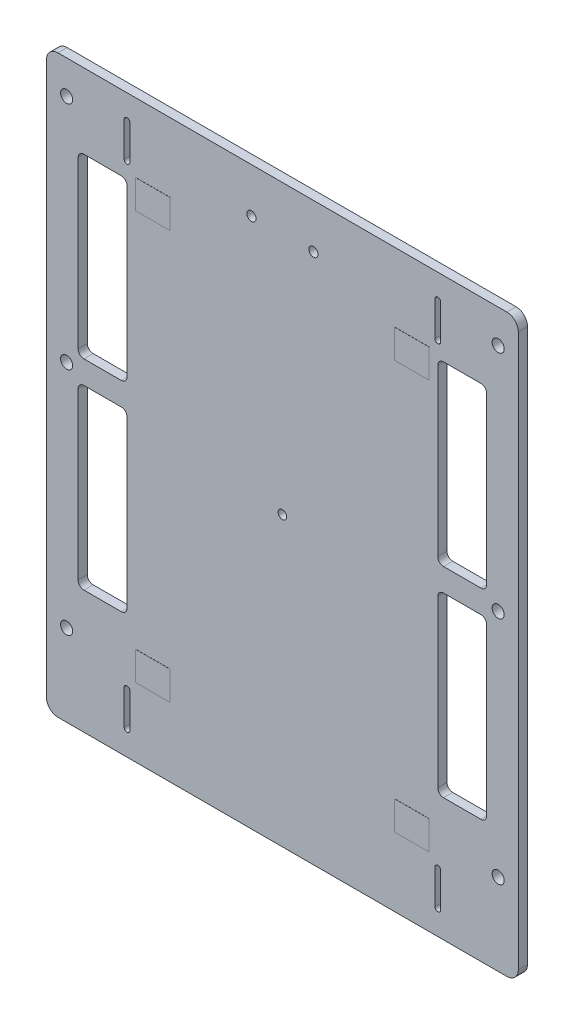
from build123d import *

# Parameters (mm, degrees)
BOSS_EXTRUDE1_DEPTH = 1.6
SKETCH2_R           = 0.75
SKETCH2_R_2         = 1.05
SKETCH2_R_3         = 0.8
CUT_EXTRUDE1_DEPTH  = 65.680445267
CUT_EXTRUDE2_DEPTH  = 65.680445267
CUT_EXTRUDE3_DEPTH  = 1.6
SKETCH5_W           = 6
SKETCH5_H           = 5
BOSS_EXTRUDE2_DEPTH = 0.02


with BuildPart() as part:
    # Sketch1 → Boss-Extrude1 (new body)
    with BuildSketch(Plane.XY):
        with BuildLine():
            Line((-39, -50), (39, -50))
            ThreePointArc((39, -50), (40.414213562, -49.414213562), (41, -48))
            Line((41, -48), (41, 48))
            ThreePointArc((41, 48), (40.414213562, 49.414213562), (39, 50))
            Line((39, 50), (-39, 50))
            ThreePointArc((-39, 50), (-40.414213562, 49.414213562), (-41, 48))
            Line((-41, 48), (-41, -48))
            ThreePointArc((-41, -48), (-40.414213562, -49.414213562), (-39, -50))
        make_face()
    extrude(amount=BOSS_EXTRUDE1_DEPTH)

    # Sketch2 → Cut-Extrude1 (cut, through all)
    with BuildSketch(Plane.XY.offset(1.6)):
        Circle(SKETCH2_R)
        with Locations((-37.5, 44.2)):
            Circle(SKETCH2_R_2)
        with Locations((37.5, 44.2)):
            Circle(SKETCH2_R_2)
        with Locations((37.5, 4.2)):
            Circle(SKETCH2_R_2)
        with Locations((37.5, -35.8)):
            Circle(SKETCH2_R_2)
        with Locations((-37.5, 4.2)):
            Circle(SKETCH2_R_2)
        with Locations((-37.5, -35.8)):
            Circle(SKETCH2_R_2)
        with Locations((-5.38, 42.25)):
            Circle(SKETCH2_R_3)
        with Locations((5.39, 42.25)):
            Circle(SKETCH2_R_3)
    extrude(amount=-CUT_EXTRUDE1_DEPTH, mode=Mode.SUBTRACT)

    # Sketch3 → Cut-Extrude2 (cut, through all)
    with BuildSketch(Plane.XY.offset(1.6)):
        with BuildLine():
            Line((-34.5, 37), (-28, 37))
            ThreePointArc((-28, 37), (-27.292893219, 36.707106781), (-27, 36))
            Line((-27, 36), (-27, 7.2))
            ThreePointArc((-27, 7.2), (-27.292893219, 6.492893219), (-28, 6.2))
            Line((-28, 6.2), (-34.5, 6.2))
            ThreePointArc((-34.5, 6.2), (-35.207106781, 6.492893219), (-35.5, 7.2))
            Line((-35.5, 7.2), (-35.5, 36))
            ThreePointArc((-35.5, 36), (-35.207106781, 36.707106781), (-34.5, 37))
        make_face()
        with BuildLine():
            Line((28, 37), (34.5, 37))
            ThreePointArc((34.5, 37), (35.207106781, 36.707106781), (35.5, 36))
            Line((35.5, 36), (35.5, 7.2))
            ThreePointArc((35.5, 7.2), (35.207106781, 6.492893219), (34.5, 6.2))
            Line((34.5, 6.2), (28, 6.2))
            ThreePointArc((28, 6.2), (27.292893219, 6.492893219), (27, 7.2))
            Line((27, 7.2), (27, 36))
            ThreePointArc((27, 36), (27.292893219, 36.707106781), (28, 37))
        make_face()
        with BuildLine():
            Line((28, 2.2), (34.5, 2.2))
            ThreePointArc((34.5, 2.2), (35.207106781, 1.907106781), (35.5, 1.2))
            Line((35.5, 1.2), (35.5, -27.6))
            ThreePointArc((35.5, -27.6), (35.207106781, -28.307106781), (34.5, -28.6))
            Line((34.5, -28.6), (28, -28.6))
            ThreePointArc((28, -28.6), (27.292893219, -28.307106781), (27, -27.6))
            Line((27, -27.6), (27, 1.2))
            ThreePointArc((27, 1.2), (27.292893219, 1.907106781), (28, 2.2))
        make_face()
        with BuildLine():
            Line((-34.5, 2.2), (-28, 2.2))
            ThreePointArc((-28, 2.2), (-27.292893219, 1.907106781), (-27, 1.2))
            Line((-27, 1.2), (-27, -27.6))
            ThreePointArc((-27, -27.6), (-27.292893219, -28.307106781), (-28, -28.6))
            Line((-28, -28.6), (-34.5, -28.6))
            ThreePointArc((-34.5, -28.6), (-35.207106781, -28.307106781), (-35.5, -27.6))
            Line((-35.5, -27.6), (-35.5, 1.2))
            ThreePointArc((-35.5, 1.2), (-35.207106781, 1.907106781), (-34.5, 2.2))
        make_face()
    extrude(amount=-CUT_EXTRUDE2_DEPTH, mode=Mode.SUBTRACT)

    # Sketch4 → Cut-Extrude3 (cut)
    with BuildSketch(Plane.XY.offset(1.6)):
        with BuildLine():
            Line((-27.5, 39.75), (-27.5, 45.75))
            ThreePointArc((-27.5, 45.75), (-27, 46.25), (-26.5, 45.75))
            Line((-26.5, 45.75), (-26.5, 39.75))
            ThreePointArc((-26.5, 39.75), (-27, 39.25), (-27.5, 39.75))
        make_face()
        with BuildLine():
            Line((26.5, 39.75), (26.5, 45.75))
            ThreePointArc((26.5, 45.75), (27, 46.25), (27.5, 45.75))
            Line((27.5, 45.75), (27.5, 39.75))
            ThreePointArc((27.5, 39.75), (27, 39.25), (26.5, 39.75))
        make_face()
        with BuildLine():
            Line((26.5, -45.75), (26.5, -39.75))
            ThreePointArc((26.5, -39.75), (27, -39.25), (27.5, -39.75))
            Line((27.5, -39.75), (27.5, -45.75))
            ThreePointArc((27.5, -45.75), (27, -46.25), (26.5, -45.75))
        make_face()
        with BuildLine():
            Line((-27.5, -45.75), (-27.5, -39.75))
            ThreePointArc((-27.5, -39.75), (-27, -39.25), (-26.5, -39.75))
            Line((-26.5, -39.75), (-26.5, -45.75))
            ThreePointArc((-26.5, -45.75), (-27, -46.25), (-27.5, -45.75))
        make_face()
    extrude(amount=-CUT_EXTRUDE3_DEPTH, mode=Mode.SUBTRACT)

    # Sketch5 → Boss-Extrude2 (add)
    with BuildSketch(Plane.XY.offset(1.6)):
        with Locations((-22.5, 35.5)):
            Rectangle(SKETCH5_W, SKETCH5_H)
        with Locations((22.5, 35.5)):
            Rectangle(SKETCH5_W, SKETCH5_H)
        with Locations((22.5, -35.5)):
            Rectangle(SKETCH5_W, SKETCH5_H)
        with Locations((-22.5, -35.5)):
            Rectangle(SKETCH5_W, SKETCH5_H)
    extrude(amount=BOSS_EXTRUDE2_DEPTH)


solid = part.part
